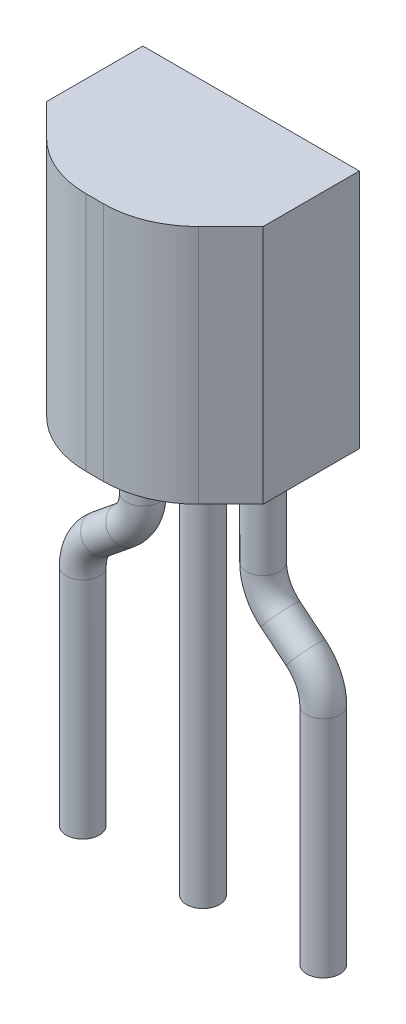
from build123d import *

# Parameters (mm, degrees)
BOSS_EXTRUDE1_DEPTH = 5.08
SKETCH2_R           = 0.35
BOSS_EXTRUDE2_DEPTH = 2
FILLET1_R           = 2
SKETCH3_R           = 0.35
BOSS_EXTRUDE3_DEPTH = 6.8
SKETCH4_R           = 0.35


with BuildPart() as part:
    # Sketch1 → Boss-Extrude1 (new body)
    with BuildSketch(Plane(origin=(0, 0, 0), x_dir=(1, 0, 0), z_dir=(0, 1, 0))):
        Polygon((-1.016, -1.016), (0.254, -2.286), (2.286, -2.286), (3.556, -1.016), (3.556, 1.016), (-1.016, 1.016), align=None)
    extrude(amount=BOSS_EXTRUDE1_DEPTH)

    # Sketch2 → Boss-Extrude2 (add)
    with BuildSketch(Plane.XZ):
        with Locations(Location((0, 0, 0), (0, 0, 270))):
            Circle(SKETCH2_R)
        with Locations(Location((1.27, 0, 0), (0, 0, 270))):
            Circle(SKETCH2_R)
        with Locations(Location((2.54, 0, 0), (0, 0, 270))):
            Circle(SKETCH2_R)
    extrude(amount=BOSS_EXTRUDE2_DEPTH)

    # Fillet1
    fillet1_edges = [part.edges().sort_by_distance(p)[0] for p in [
        (2.286, 2.54, 2.286),
        (0.254, 2.54, 2.286),
    ]]
    fillet(fillet1_edges, radius=FILLET1_R)

    # Sketch3 → Boss-Extrude3 (add)
    with BuildSketch(Plane.XZ.offset(2)):
        with Locations(Location((1.27, 0, 0), (0, 0, 270))):
            Circle(SKETCH3_R)
    extrude(amount=BOSS_EXTRUDE3_DEPTH)

    # Sweep1: sweep along a path in Sketch5
    with BuildLine(Plane.XY) as sweep1_path:
        Line((3.81, -8.8), (3.81, -4.059360967))
        ThreePointArc((3.81, -4.059360967), (3.713203685, -3.630148778), (3.441553795, -3.284028906))
        Line((3.441553795, -3.284028906), (2.908446205, -2.849781262))
        ThreePointArc((2.908446205, -2.849781262), (2.636796315, -2.503661389), (2.54, -2.074449201))
        Line((2.54, -2.074449201), (2.54, -2))
    # Sketch4 → Sweep1 (sweep)
    with BuildSketch(Plane.XZ.offset(8.8)):
        with Locations((3.81, 0)):
            Circle(SKETCH4_R)
    sweep1 = sweep(path=sweep1_path.line)

    # Mirror1: Sweep1 across plane
    add(sweep1.mirror(Plane(origin=(1.27, 0, 0), x_dir=(0, 0, 1), z_dir=(1, 0, 0))))


solid = part.part
